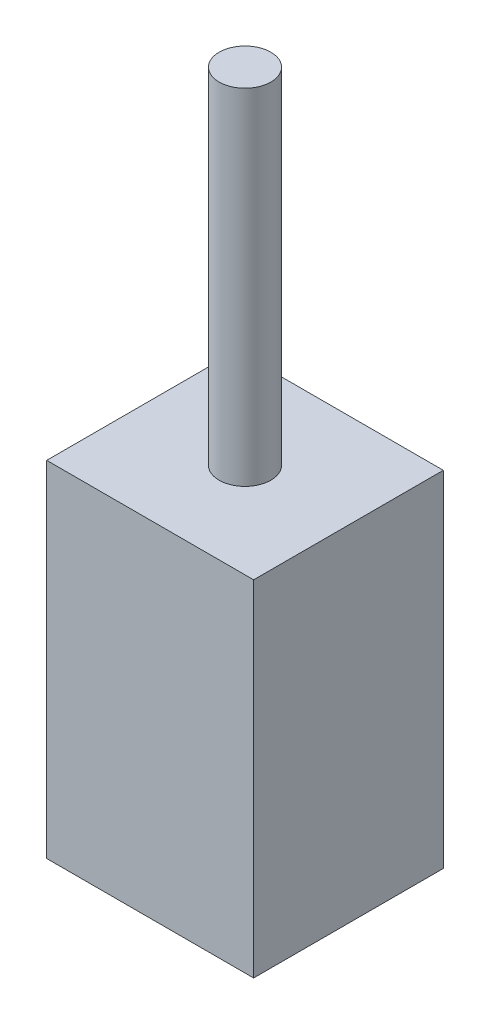
from build123d import *

# Parameters (mm, degrees)
SKETCH1_W           = 12
SKETCH1_H           = 11
BOSS_EXTRUDE1_DEPTH = 20
SKETCH2_R           = 1.5
BOSS_EXTRUDE2_DEPTH = 20


with BuildPart() as part:
    # Sketch1 → Boss-Extrude1 (new body)
    with BuildSketch(Plane(origin=(0, 0, 0), x_dir=(1, 0, 0), z_dir=(0, 1, 0))):
        with Locations((6, 5.5)):
            Rectangle(SKETCH1_W, SKETCH1_H)
    extrude(amount=BOSS_EXTRUDE1_DEPTH)

    # Sketch2 → Boss-Extrude2 (add)
    with BuildSketch(Plane(origin=(0, 20, 0), x_dir=(1, 0, 0), z_dir=(0, 1, 0))):
        with Locations(Location((6, 5.5, 0), (0, 0, 270))):
            Circle(SKETCH2_R)
    extrude(amount=BOSS_EXTRUDE2_DEPTH)


solid = part.part
